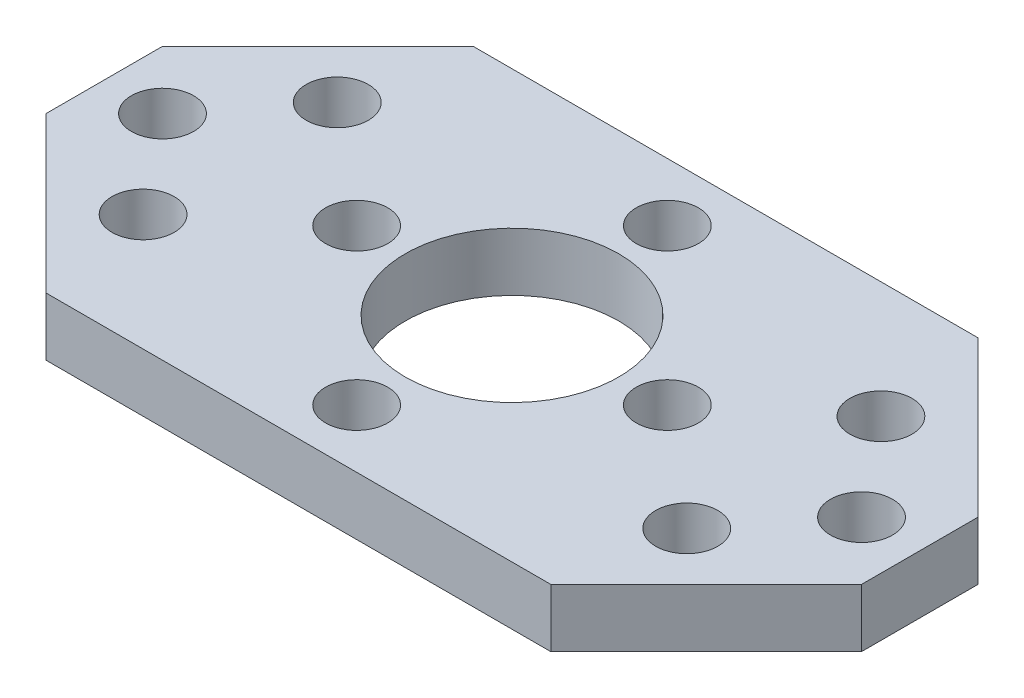
from build123d import *

# Parameters (mm, degrees)
SKETCH_1_R      = 1.6
SKETCH_1_R_2    = 5.5
EXTRUDE_1_DEPTH = 3


with BuildPart() as part:
    # 草图1 → 凸台-拉伸1 (new body)
    with BuildSketch(Plane(origin=(0, 0, 0), x_dir=(1, 0, 0), z_dir=(0, 1, 0))):
        Polygon((-21, 3), (-13, 11), (13, 11), (21, 3), (21, -3), (13, -11), (-13, -11), (-21, -3), align=None)
        with Locations(Location((0, 8, 0), (0, 0, 270))):
            Circle(SKETCH_1_R, mode=Mode.SUBTRACT)
        with Locations(Location((8, 0, 0), (0, 0, 270))):
            Circle(SKETCH_1_R, mode=Mode.SUBTRACT)
        with Locations(Location((-8, 0, 0), (0, 0, 90))):
            Circle(SKETCH_1_R, mode=Mode.SUBTRACT)
        with Locations(Location((0, 0, 0), (0, 0, 270))):
            Circle(SKETCH_1_R_2, mode=Mode.SUBTRACT)
        with Locations(Location((0, -8, 0), (0, 0, 90))):
            Circle(SKETCH_1_R, mode=Mode.SUBTRACT)
        with Locations(Location((-18, 0, 0), (0, 0, 270))):
            Circle(SKETCH_1_R, mode=Mode.SUBTRACT)
        with Locations(Location((-14, 5, 0), (0, 0, 270))):
            Circle(SKETCH_1_R, mode=Mode.SUBTRACT)
        with Locations(Location((-14, -5, 0), (0, 0, 90))):
            Circle(SKETCH_1_R, mode=Mode.SUBTRACT)
        with Locations(Location((14, -5, 0), (0, 0, 270))):
            Circle(SKETCH_1_R, mode=Mode.SUBTRACT)
        with Locations(Location((18, 0, 0), (0, 0, 90))):
            Circle(SKETCH_1_R, mode=Mode.SUBTRACT)
        with Locations(Location((14, 5, 0), (0, 0, 90))):
            Circle(SKETCH_1_R, mode=Mode.SUBTRACT)
    extrude(amount=EXTRUDE_1_DEPTH)


solid = part.part
